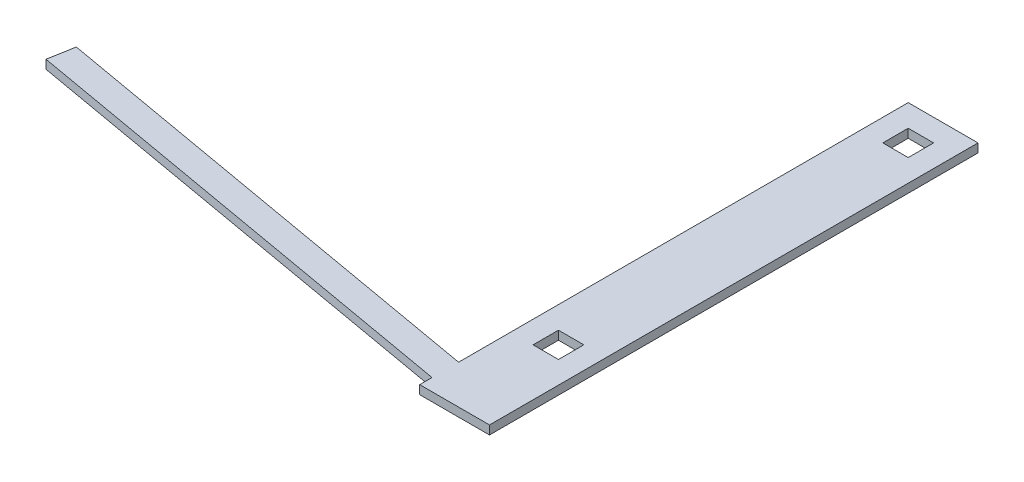
from build123d import *

# Parameters (mm, degrees)
SKETCH1_W           = 12.7
SKETCH1_H           = 88.9
SKETCH1_W_2         = 4.62
SKETCH1_H_2         = 4.62
BOSS_EXTRUDE1_DEPTH = 1.5875
BOSS_EXTRUDE2_DEPTH = 1.5875


with BuildPart() as part:
    # Sketch1 → Boss-Extrude1 (new body)
    with BuildSketch(Plane(origin=(0, 0, 0), x_dir=(1, 0, 0), z_dir=(0, 1, 0))):
        with Locations((6.358064201, 57.44278115)):
            Rectangle(SKETCH1_W, SKETCH1_H)
        with Locations((6.358064201, 95.54278115)):
            Rectangle(SKETCH1_W_2, SKETCH1_H_2, mode=Mode.SUBTRACT)
        with Locations((6.358064201, 31.89278115)):
            Rectangle(SKETCH1_W_2, SKETCH1_H_2, mode=Mode.SUBTRACT)
    extrude(amount=BOSS_EXTRUDE1_DEPTH)

    # Sketch2 → Boss-Extrude2 (add)
    with BuildSketch(Plane.XZ):
        Polygon((0.008064201, -20.068103044), (0.008064201, -15.232133805), (-85.280307223, -30.270774828), (-84.453307777, -34.960921752), align=None)
    extrude(amount=-BOSS_EXTRUDE2_DEPTH)


solid = part.part
